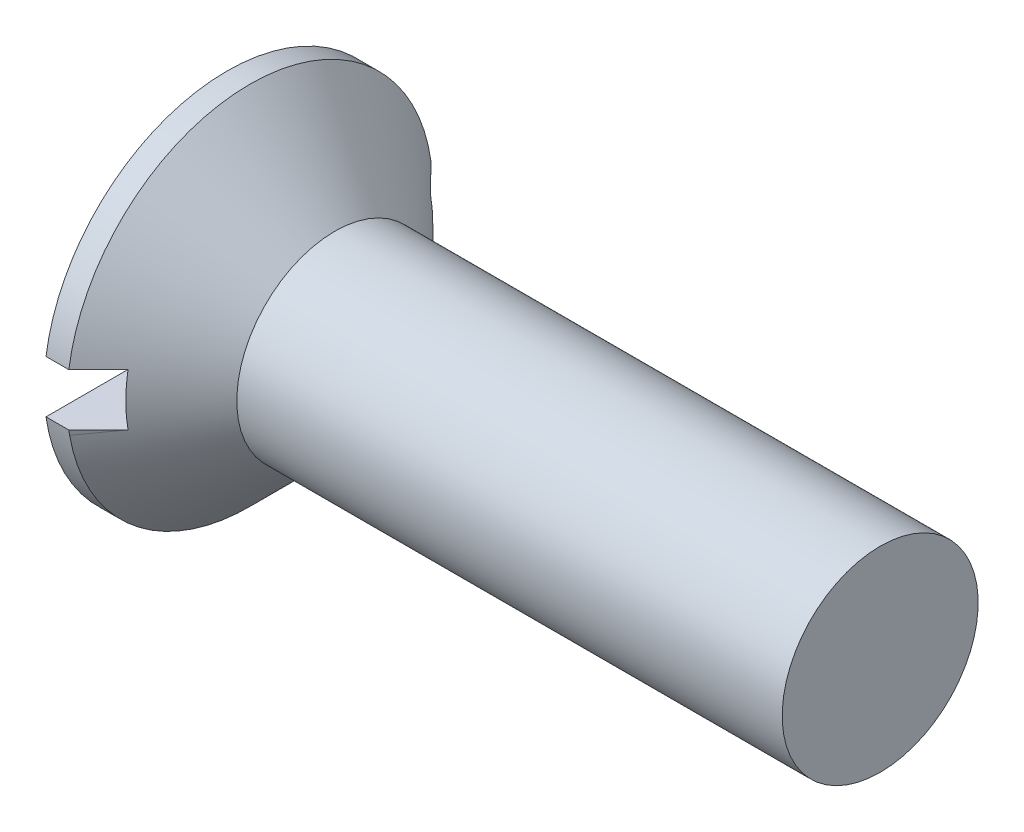
from build123d import *

# Parameters (mm, degrees)
SKETCH2_W          = 5.6
SKETCH2_H          = 0.8
CUT_EXTRUDE1_DEPTH = 0.8


with BuildPart() as part:
    # Sketch1 → Revolve1 (revolve)
    with BuildSketch(Plane.XY):
        Polygon((0, 0), (0, 2.8), (0.35, 2.8), (1.65, 1.5), (10, 1.5), (10, 0), align=None)
    revolve(axis=Axis((10, 0, 0), (-1, 0, 0)))

    # Sketch2 → Cut-Extrude1 (cut)
    with BuildSketch(Plane.ZY):
        Rectangle(SKETCH2_W, SKETCH2_H)
    extrude(amount=-CUT_EXTRUDE1_DEPTH, mode=Mode.SUBTRACT)


solid = part.part
